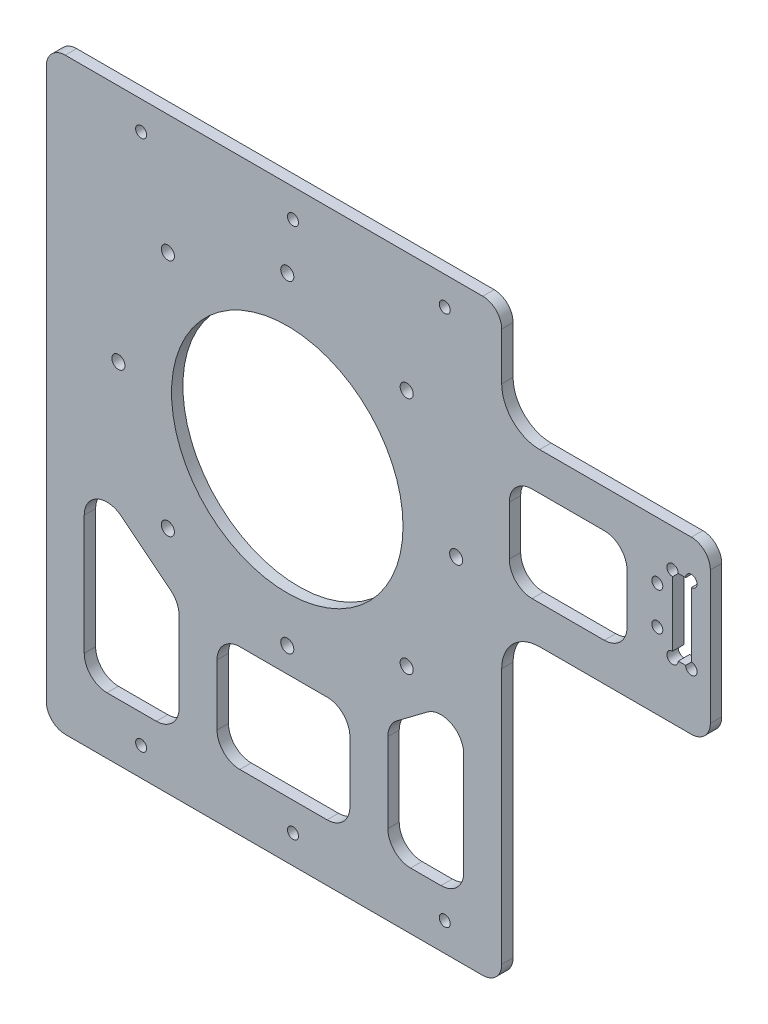
from build123d import *

# Parameters (mm, degrees)
SKETCH_1_W          = 120
SKETCH_1_H          = 155
SKETCH_1_R          = 1.45
SKETCH_1_R_2        = 30.5
SKETCH_1_R_3        = 1.725
SKETCH_1_W_2        = 35
SKETCH_1_H_2        = 28
SKETCH_1_W_3        = 54.975
SKETCH_1_H_3        = 45
SKETCH_1_W_4        = 4.95
SKETCH_1_H_4        = 20
EXTRUDE_1_DEPTH     = 3
FILLET_1_R          = 6
FILLET_2_R          = 10
SKETCH_2_W          = 31.025
SKETCH_2_H          = 25
CUT_EXTRUDE_1_DEPTH = 197.04591299
FILLET_3_R          = 6
FILLET_4_R          = 5
SKETCH_3_R          = 1.5
CUT_EXTRUDE_2_DEPTH = 197.04591299


with BuildPart() as part:
    # 草图1 → 凸台-拉伸1 (new body)
    # profile 1 of 2: a face of its own
    with BuildSketch(Plane.XY):
        with Locations((-60, 77.5)):
            Rectangle(SKETCH_1_W, SKETCH_1_H)
        with Locations((-15, 7.5)):
            Circle(SKETCH_1_R, mode=Mode.SUBTRACT)
        with Locations((-55, 7.5)):
            Circle(SKETCH_1_R, mode=Mode.SUBTRACT)
        with Locations((-15, 147.5)):
            Circle(SKETCH_1_R, mode=Mode.SUBTRACT)
        with Locations((-55, 147.5)):
            Circle(SKETCH_1_R, mode=Mode.SUBTRACT)
        with Locations((-56.5, 92)):
            Circle(SKETCH_1_R_2, mode=Mode.SUBTRACT)
        with Locations((-56.5, 134.5)):
            Circle(SKETCH_1_R_3, mode=Mode.SUBTRACT)
        with Locations((-56.5, 49.5)):
            Circle(SKETCH_1_R_3, mode=Mode.SUBTRACT)
        with Locations((-87.966251763, 123.466251763)):
            Circle(SKETCH_1_R_3, mode=Mode.SUBTRACT)
        with Locations((-87.966251763, 60.533748237)):
            Circle(SKETCH_1_R_3, mode=Mode.SUBTRACT)
        with Locations((-25.033748237, 60.533748237)):
            Circle(SKETCH_1_R_3, mode=Mode.SUBTRACT)
        with Locations((-25.033748237, 123.466251763)):
            Circle(SKETCH_1_R_3, mode=Mode.SUBTRACT)
        with Locations((-12, 92)):
            Circle(SKETCH_1_R_3, mode=Mode.SUBTRACT)
        with Locations((-101, 92)):
            Circle(SKETCH_1_R_3, mode=Mode.SUBTRACT)
        with Locations((-95, 7.5)):
            Circle(SKETCH_1_R, mode=Mode.SUBTRACT)
        with Locations((-95, 147.5)):
            Circle(SKETCH_1_R, mode=Mode.SUBTRACT)
        Polygon((-110, 65), (-110, 15), (-85, 15), (-85, 45), align=None, mode=Mode.SUBTRACT)
        with Locations((-57.5, 29)):
            Rectangle(SKETCH_1_W_2, SKETCH_1_H_2, mode=Mode.SUBTRACT)
        Polygon((-10, 60), (-10, 15), (-30, 15), (-30, 45), align=None, mode=Mode.SUBTRACT)
    # profile 2 of 2: a face of its own
    with BuildSketch(Plane.XY):
        with Locations((27.4875, 105)):
            Rectangle(SKETCH_1_W_3, SKETCH_1_H_3)
        with Locations((41, 102.5)):
            Circle(SKETCH_1_R, mode=Mode.SUBTRACT)
        with Locations((41, 112.5)):
            Circle(SKETCH_1_R, mode=Mode.SUBTRACT)
        with Locations((47.5, 107.5)):
            Rectangle(SKETCH_1_W_4, SKETCH_1_H_4, mode=Mode.SUBTRACT)
    extrude(amount=EXTRUDE_1_DEPTH)

    # 圆角1
    fillet_1_edges = [part.edges().sort_by_distance(p)[0] for p in [
        (-75, 43, 1.5),
        (-75, 15, 1.5),
        (-40, 15, 1.5),
        (-40, 43, 1.5),
        (-110, 65, 1.5),
        (-110, 15, 1.5),
        (-85, 15, 1.5),
        (-85, 45, 1.5),
        (-30, 15, 1.5),
        (-10, 15, 1.5),
        (-10, 60, 1.5),
        (-30, 45, 1.5),
    ]]
    fillet(fillet_1_edges, radius=FILLET_1_R)

    # 圆角2
    fillet_2_edges = [part.edges().sort_by_distance(p)[0] for p in [
        (0, 82.5, 1.5),
        (0, 127.5, 1.5),
    ]]
    fillet(fillet_2_edges, radius=FILLET_2_R)

    # 草图2 → 切除-拉伸1 (cut, through all)
    with BuildSketch(Plane.XY.offset(3)):
        with Locations((17.5125, 105)):
            Rectangle(SKETCH_2_W, SKETCH_2_H)
    extrude(amount=-CUT_EXTRUDE_1_DEPTH, mode=Mode.SUBTRACT)

    # 圆角3
    fillet_3_edges = [part.edges().sort_by_distance(p)[0] for p in [
        (2, 92.5, 1.5),
        (2, 117.5, 1.5),
        (33.025, 117.5, 1.5),
        (33.025, 92.5, 1.5),
    ]]
    fillet(fillet_3_edges, radius=FILLET_3_R)

    # 圆角4
    fillet_4_edges = [part.edges().sort_by_distance(p)[0] for p in [
        (54.975, 82.5, 1.5),
        (0, 0, 1.5),
        (-120, 0, 1.5),
        (-120, 155, 1.5),
        (0, 155, 1.5),
        (54.975, 127.5, 1.5),
    ]]
    fillet(fillet_4_edges, radius=FILLET_4_R)

    # 草图3 → 切除-拉伸2 (cut, through all)
    with BuildSketch(Plane.XY.offset(3)):
        with Locations((45.025, 117.5)):
            Circle(SKETCH_3_R)
        with Locations((49.975, 117.5)):
            Circle(SKETCH_3_R)
        with Locations((45.025, 97.5)):
            Circle(SKETCH_3_R)
        with Locations((49.975, 97.5)):
            Circle(SKETCH_3_R)
    extrude(amount=-CUT_EXTRUDE_2_DEPTH, mode=Mode.SUBTRACT)


solid = part.part
